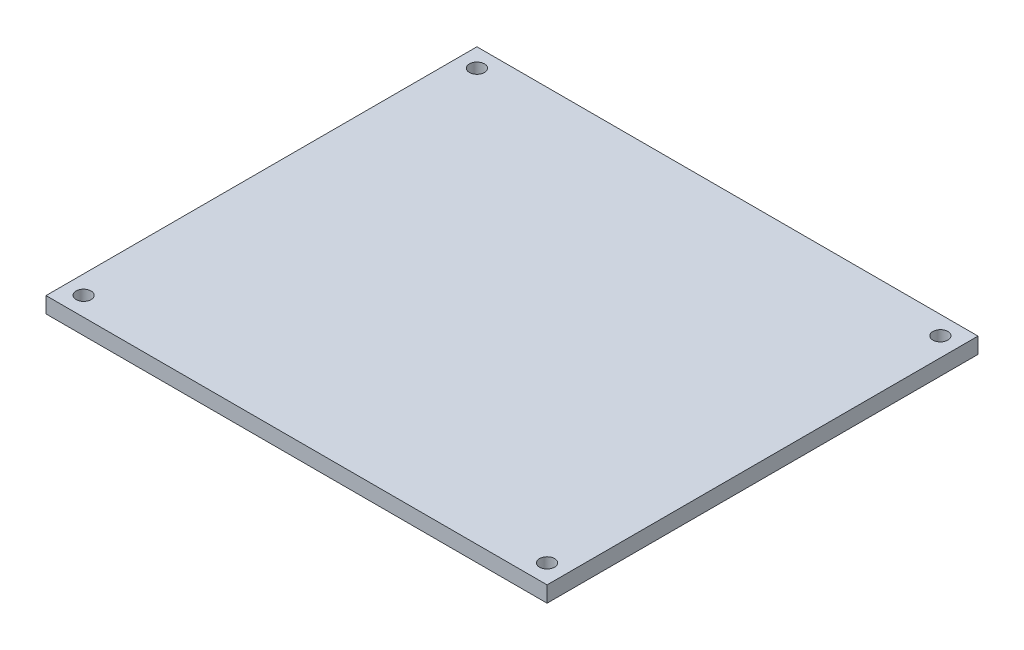
from build123d import *

# Parameters (mm, degrees)
SKETCH1_W           = 100
SKETCH1_H           = 86
SKETCH1_R           = 1.5
BOSS_EXTRUDE1_DEPTH = 3.175


with BuildPart() as part:
    # Sketch1 → Boss-Extrude1 (new body)
    with BuildSketch(Plane(origin=(0, 0, 0), x_dir=(1, 0, 0), z_dir=(0, 1, 0))):
        with Locations((50, 43)):
            Rectangle(SKETCH1_W, SKETCH1_H)
        with Locations(Location((3.7, 3.8, 0), (0, 0, 270))):
            Circle(SKETCH1_R, mode=Mode.SUBTRACT)
        with Locations(Location((96.2, 3.8, 0), (0, 0, 270))):
            Circle(SKETCH1_R, mode=Mode.SUBTRACT)
        with Locations(Location((3.7, 82.3, 0), (0, 0, 270))):
            Circle(SKETCH1_R, mode=Mode.SUBTRACT)
        with Locations(Location((96.2, 82.3, 0), (0, 0, 270))):
            Circle(SKETCH1_R, mode=Mode.SUBTRACT)
    extrude(amount=BOSS_EXTRUDE1_DEPTH)


solid = part.part
